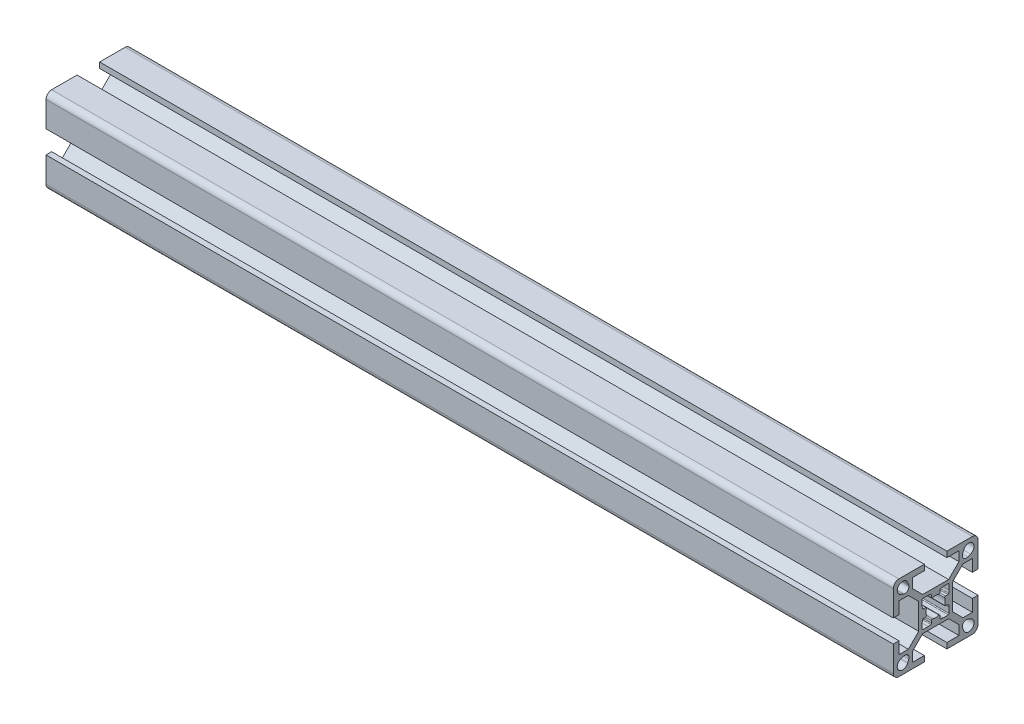
from build123d import *

# Parameters (mm, degrees)
BOSS_EXTRUDE1_DEPTH = 300


with BuildPart() as part:
    # Sketch1 → Boss-Extrude1 (new body)
    with BuildSketch(Plane(origin=(0, 0, 0), x_dir=(0, 0, -1), z_dir=(1, 0, 0))):
        with BuildLine():
            Line((-15, 13), (-15, 4))
            Line((-15, 4), (-13, 4))
            Line((-13, 4), (-13, 8.25))
            Line((-13, 8.25), (-9.664213562, 8.25))
            Line((-9.664213562, 8.25), (-6, 4.585786438))
            Line((-6, 4.585786438), (-6, -4.585786438))
            Line((-6, -4.585786438), (-9.664213562, -8.25))
            Line((-9.664213562, -8.25), (-13, -8.25))
            Line((-13, -8.25), (-13, -4))
            Line((-13, -4), (-15, -4))
            Line((-15, -4), (-15, -13))
            ThreePointArc((-15, -13), (-14.414213562, -14.414213562), (-13, -15))
            Line((-13, -15), (-4, -15))
            Line((-4, -15), (-4, -13))
            Line((-4, -13), (-8.25, -13))
            Line((-8.25, -13), (-8.25, -9.664213562))
            Line((-8.25, -9.664213562), (-4.585786438, -6))
            Line((-4.585786438, -6), (4.585786438, -6))
            Line((4.585786438, -6), (8.25, -9.664213562))
            Line((8.25, -9.664213562), (8.25, -13))
            Line((8.25, -13), (4, -13))
            Line((4, -13), (4, -15))
            Line((4, -15), (13, -15))
            ThreePointArc((13, -15), (14.414213562, -14.414213562), (15, -13))
            Line((15, -13), (15, -4))
            Line((15, -4), (13, -4))
            Line((13, -4), (13, -8.25))
            Line((13, -8.25), (9.664213562, -8.25))
            Line((9.664213562, -8.25), (6, -4.585786438))
            Line((6, -4.585786438), (6, 4.585786438))
            Line((6, 4.585786438), (9.664213562, 8.25))
            Line((9.664213562, 8.25), (13, 8.25))
            Line((13, 8.25), (13, 4))
            Line((13, 4), (15, 4))
            Line((15, 4), (15, 13))
            ThreePointArc((15, 13), (14.414213562, 14.414213562), (13, 15))
            Line((13, 15), (4, 15))
            Line((4, 15), (4, 13))
            Line((4, 13), (8.25, 13))
            Line((8.25, 13), (8.25, 9.664213562))
            Line((8.25, 9.664213562), (4.585786438, 6))
            Line((4.585786438, 6), (-4.585786438, 6))
            Line((-4.585786438, 6), (-8.25, 9.664213562))
            Line((-8.25, 9.664213562), (-8.25, 13))
            Line((-8.25, 13), (-4, 13))
            Line((-4, 13), (-4, 15))
            Line((-4, 15), (-13, 15))
            ThreePointArc((-13, 15), (-14.414213562, 14.414213562), (-15, 13))
        make_face()
        with BuildLine():
            Line((-9.539070071, 11.338915743), (-9.918883282, 12.361530981))
            ThreePointArc((-9.918883282, 12.361530981), (-13.043502884, 13.043502884), (-12.361530981, 9.918883282))
            Line((-12.361530981, 9.918883282), (-11.338915743, 9.539070071))
            ThreePointArc((-11.338915743, 9.539070071), (-9.861522369, 9.861522369), (-9.539070071, 11.338915743))
        make_face(mode=Mode.SUBTRACT)
        with BuildLine():
            Line((9.918883282, 12.361530981), (9.539070071, 11.338915743))
            ThreePointArc((9.539070071, 11.338915743), (9.861522369, 9.861522369), (11.338915743, 9.539070071))
            Line((11.338915743, 9.539070071), (12.361530981, 9.918883282))
            ThreePointArc((12.361530981, 9.918883282), (13.043502884, 13.043502884), (9.918883282, 12.361530981))
        make_face(mode=Mode.SUBTRACT)
        with BuildLine():
            Line((12.361530981, -9.918883282), (11.338915743, -9.539070071))
            ThreePointArc((11.338915743, -9.539070071), (9.861522369, -9.861522369), (9.539070071, -11.338915743))
            Line((9.539070071, -11.338915743), (9.918883282, -12.361530981))
            ThreePointArc((9.918883282, -12.361530981), (13.043502884, -13.043502884), (12.361530981, -9.918883282))
        make_face(mode=Mode.SUBTRACT)
        with BuildLine():
            Line((-11.338915743, -9.539070071), (-12.361530981, -9.918883282))
            ThreePointArc((-12.361530981, -9.918883282), (-13.043502884, -13.043502884), (-9.918883282, -12.361530981))
            Line((-9.918883282, -12.361530981), (-9.539070071, -11.338915743))
            ThreePointArc((-9.539070071, -11.338915743), (-9.861522369, -9.861522369), (-11.338915743, -9.539070071))
        make_face(mode=Mode.SUBTRACT)
        with BuildLine():
            Line((-4.8, -2.644433572), (-4.8, -4.5))
            ThreePointArc((-4.8, -4.5), (-4.712132034, -4.712132034), (-4.5, -4.8))
            Line((-4.5, -4.8), (-2.644433572, -4.8))
            ThreePointArc((-2.644433572, -4.8), (-2.615679847, -4.79861886), (-2.587190874, -4.794488155))
            Line((-2.587190874, -4.794488155), (-1.742757301, -4.630346896))
            ThreePointArc((-1.742757301, -4.630346896), (-1.568512625, -4.526682207), (-1.5, -4.335858741))
            Line((-1.5, -4.335858741), (-1.5, -3.5))
            ThreePointArc((-1.5, -3.5), (-1.374371458, -3.255879959), (-1.102702703, -3.216216216))
            ThreePointArc((-1.102702703, -3.216216216), (0, -3.4), (1.102702703, -3.216216216))
            ThreePointArc((1.102702703, -3.216216216), (1.374371458, -3.255879959), (1.5, -3.5))
            Line((1.5, -3.5), (1.5, -4.335858741))
            ThreePointArc((1.5, -4.335858741), (1.568512625, -4.526682207), (1.742757301, -4.630346896))
            Line((1.742757301, -4.630346896), (2.587190874, -4.794488155))
            ThreePointArc((2.587190874, -4.794488155), (2.615679847, -4.79861886), (2.644433572, -4.8))
            Line((2.644433572, -4.8), (4.5, -4.8))
            ThreePointArc((4.5, -4.8), (4.712132034, -4.712132034), (4.8, -4.5))
            Line((4.8, -4.5), (4.8, -2.644433572))
            ThreePointArc((4.8, -2.644433572), (4.79861886, -2.615679847), (4.794488155, -2.587190874))
            Line((4.794488155, -2.587190874), (4.630346896, -1.742757301))
            ThreePointArc((4.630346896, -1.742757301), (4.526682207, -1.568512625), (4.335858741, -1.5))
            Line((4.335858741, -1.5), (3.5, -1.5))
            ThreePointArc((3.5, -1.5), (3.255879959, -1.374371458), (3.216216216, -1.102702703))
            ThreePointArc((3.216216216, -1.102702703), (3.4, 0), (3.216216216, 1.102702703))
            ThreePointArc((3.216216216, 1.102702703), (3.255879959, 1.374371458), (3.5, 1.5))
            Line((3.5, 1.5), (4.335858741, 1.5))
            ThreePointArc((4.335858741, 1.5), (4.526682207, 1.568512625), (4.630346896, 1.742757301))
            Line((4.630346896, 1.742757301), (4.794488155, 2.587190874))
            ThreePointArc((4.794488155, 2.587190874), (4.79861886, 2.615679847), (4.8, 2.644433572))
            Line((4.8, 2.644433572), (4.8, 4.5))
            ThreePointArc((4.8, 4.5), (4.712132034, 4.712132034), (4.5, 4.8))
            Line((4.5, 4.8), (2.644433572, 4.8))
            ThreePointArc((2.644433572, 4.8), (2.615679847, 4.79861886), (2.587190874, 4.794488155))
            Line((2.587190874, 4.794488155), (1.742757301, 4.630346896))
            ThreePointArc((1.742757301, 4.630346896), (1.568512625, 4.526682207), (1.5, 4.335858741))
            Line((1.5, 4.335858741), (1.5, 3.5))
            ThreePointArc((1.5, 3.5), (1.374371458, 3.255879959), (1.102702703, 3.216216216))
            ThreePointArc((1.102702703, 3.216216216), (0, 3.4), (-1.102702703, 3.216216216))
            ThreePointArc((-1.102702703, 3.216216216), (-1.374371458, 3.255879959), (-1.5, 3.5))
            Line((-1.5, 3.5), (-1.5, 4.335858741))
            ThreePointArc((-1.5, 4.335858741), (-1.568512625, 4.526682207), (-1.742757301, 4.630346896))
            Line((-1.742757301, 4.630346896), (-2.587190874, 4.794488155))
            ThreePointArc((-2.587190874, 4.794488155), (-2.615679847, 4.79861886), (-2.644433572, 4.8))
            Line((-2.644433572, 4.8), (-4.5, 4.8))
            ThreePointArc((-4.5, 4.8), (-4.712132034, 4.712132034), (-4.8, 4.5))
            Line((-4.8, 4.5), (-4.8, 2.644433572))
            ThreePointArc((-4.8, 2.644433572), (-4.79861886, 2.615679847), (-4.794488155, 2.587190874))
            Line((-4.794488155, 2.587190874), (-4.630346896, 1.742757301))
            ThreePointArc((-4.630346896, 1.742757301), (-4.526682207, 1.568512625), (-4.335858741, 1.5))
            Line((-4.335858741, 1.5), (-3.5, 1.5))
            ThreePointArc((-3.5, 1.5), (-3.255879959, 1.374371458), (-3.216216216, 1.102702703))
            ThreePointArc((-3.216216216, 1.102702703), (-3.4, 0), (-3.216216216, -1.102702703))
            ThreePointArc((-3.216216216, -1.102702703), (-3.255879959, -1.374371458), (-3.5, -1.5))
            Line((-3.5, -1.5), (-4.335858741, -1.5))
            ThreePointArc((-4.335858741, -1.5), (-4.526682207, -1.568512625), (-4.630346896, -1.742757301))
            Line((-4.630346896, -1.742757301), (-4.794488155, -2.587190874))
            ThreePointArc((-4.794488155, -2.587190874), (-4.79861886, -2.615679847), (-4.8, -2.644433572))
        make_face(mode=Mode.SUBTRACT)
    extrude(amount=BOSS_EXTRUDE1_DEPTH)


solid = part.part
